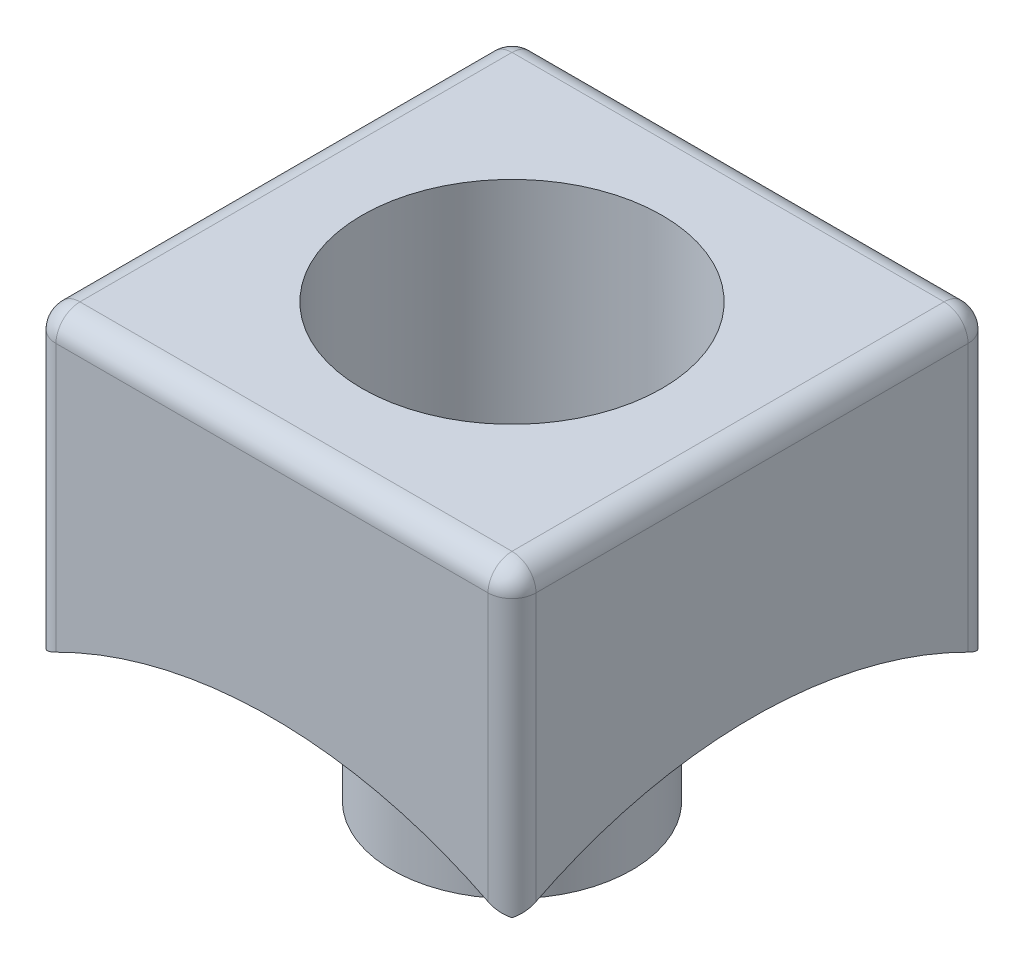
from build123d import *

# Parameters (mm, degrees)
IZIM1_W                     = 20
IZIM1_H                     = 20
Y_KSEKLIK_EKSTR_ZYON1_DEPTH = 10
BO_ALTMA1_T                 = -1
IZIM2_R                     = 7
Y_KSEKLIK_EKSTR_ZYON2_DEPTH = 17
IZIM3_R                     = 20
KES_EKSTR_ZYON2_DEPTH       = 1
IZIM4_R                     = 20
KES_EKSTR_ZYON3_DEPTH       = 1
IZIM5_R                     = 6.25
KES_EKSTR_ZYON4_DEPTH       = 12
IZIM6_R                     = 3.25
KES_EKSTR_ZYON5_DEPTH       = 10
IZIM7_R                     = 8
IZIM7_R_2                   = 5
KES_EKSTR_ZYON6_DEPTH       = 5
RADYUS2_R                   = 1


with BuildPart() as part:
    # Çizim1 → Yükseklik-Ekstrüzyon1 (new, symmetric)
    with BuildSketch(Plane.XY):
        Rectangle(IZIM1_W, IZIM1_H)
    extrude(amount=Y_KSEKLIK_EKSTR_ZYON1_DEPTH, both=True)

    # İç Boşaltma1
    bo_altma1_openings = [part.faces().sort_by_distance(p)[0] for p in [
        (0, -10, 0),
    ]]
    offset(amount=BO_ALTMA1_T, openings=bo_altma1_openings, kind=Kind.INTERSECTION)

    # Çizim2 → Yükseklik-Ekstrüzyon2 (add)
    with BuildSketch(Plane.XZ.offset(-9)):
        with Locations(Location((0, 0, 0), (0, 0, 270))):
            Circle(IZIM2_R)
    extrude(amount=Y_KSEKLIK_EKSTR_ZYON2_DEPTH)

    # Çizim3 → Kes-Ekstrüzyon2 (cut)
    with BuildSketch(Plane.ZY.offset(10)):
        with Locations((0, -20)):
            Circle(IZIM3_R)
    kes_ekstr_zyon2 = extrude(amount=-KES_EKSTR_ZYON2_DEPTH, mode=Mode.SUBTRACT)

    # Aynalama1: Kes-Ekstrüzyon2 across plane
    add(kes_ekstr_zyon2.mirror(Plane(origin=(0, 0, 0), x_dir=(0, 0, 1), z_dir=(1, 0, 0))), mode=Mode.SUBTRACT)

    # Çizim4 → Kes-Ekstrüzyon3 (cut)
    with BuildSketch(Plane.XY.offset(10)):
        with Locations((0, -20)):
            Circle(IZIM4_R)
    kes_ekstr_zyon3 = extrude(amount=-KES_EKSTR_ZYON3_DEPTH, mode=Mode.SUBTRACT)

    # Aynalama2: Kes-Ekstrüzyon3 across plane
    add(kes_ekstr_zyon3.mirror(Plane.XY), mode=Mode.SUBTRACT)

    # Çizim5 → Kes-Ekstrüzyon4 (cut)
    with BuildSketch(Plane(origin=(0, 10, 0), x_dir=(1, 0, 0), z_dir=(0, 1, 0))):
        with Locations(Location((0, 0, 0), (0, 0, 270))):
            Circle(IZIM5_R)
    extrude(amount=-KES_EKSTR_ZYON4_DEPTH, mode=Mode.SUBTRACT)

    # Çizim6 → Kes-Ekstrüzyon5 (cut)
    with BuildSketch(Plane(origin=(0, -2, 0), x_dir=(1, 0, 0), z_dir=(0, 1, 0))):
        with Locations(Location((0, 0, 0), (0, 0, 270))):
            Circle(IZIM6_R)
    extrude(amount=-KES_EKSTR_ZYON5_DEPTH, mode=Mode.SUBTRACT)

    # Çizim7 → Kes-Ekstrüzyon6 (cut)
    with BuildSketch(Plane.XZ.offset(8)):
        Circle(IZIM7_R)
        with Locations(Location((0, 0, 0), (0, 0, 270))):
            Circle(IZIM7_R_2, mode=Mode.SUBTRACT)
    extrude(amount=-KES_EKSTR_ZYON6_DEPTH, mode=Mode.SUBTRACT)

    # Radyus2
    radyus2_edges = [part.edges().sort_by_distance(p)[0] for p in [
        (-10, 3.660254038, 10),
        (10, 3.660254038, -10),
        (10, 3.660254038, 10),
        (-10, 3.660254038, -10),
        (0, 10, -10),
        (0, 10, 10),
        (-10, 10, 0),
        (10, 10, 0),
    ]]
    fillet(radyus2_edges, radius=RADYUS2_R)


solid = part.part
